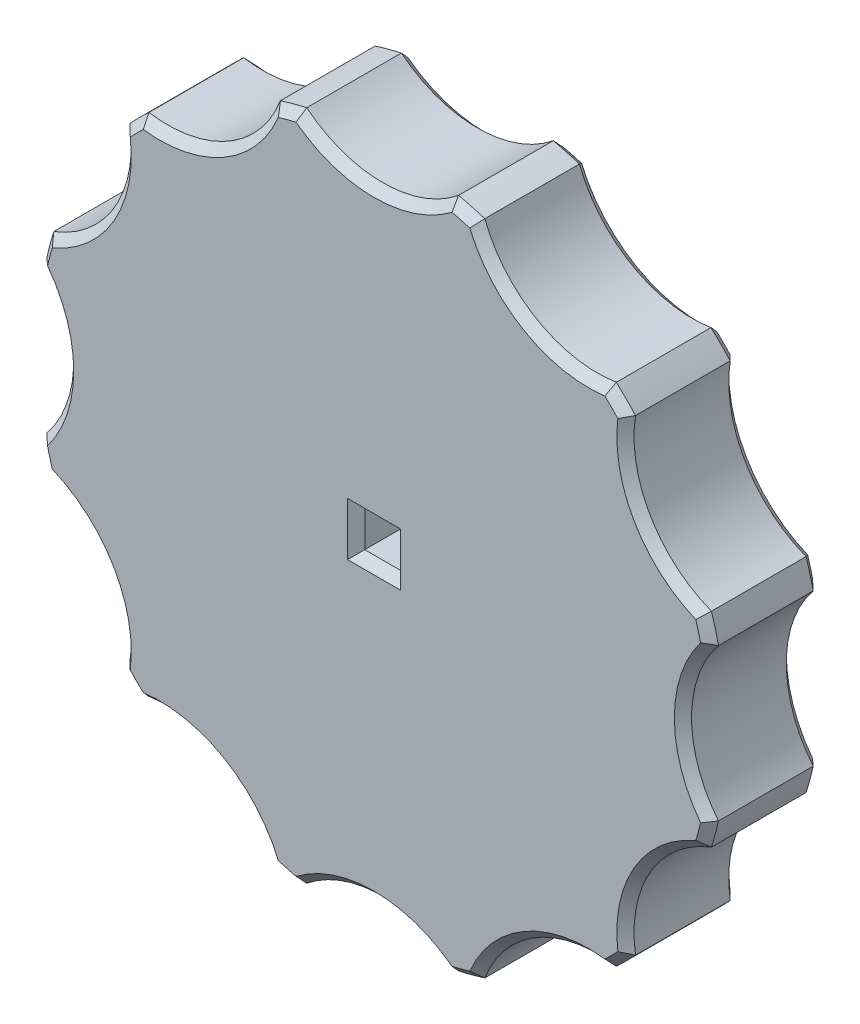
from build123d import *

# Parameters (mm, degrees)
SKIZZE1_R                       = 20
SKIZZE1_W                       = 2.08
SKIZZE1_H                       = 2.08
AUFSATZ_LINEAR_AUSTRAGEN1_DEPTH = 6.5
SCHNITT_LINEAR_AUSTRAGEN1_DEPTH = 6.5
KREISMUSTER1_COUNT              = 12
FASE1_SIZE                      = 0.5


with BuildPart() as part:
    # Skizze1 → Aufsatz-Linear austragen1 (new body)
    with BuildSketch(Plane.XY):
        with Locations(Location((0, 0, 0), (0, 0, 180))):
            Circle(SKIZZE1_R)
        Rectangle(SKIZZE1_W, SKIZZE1_H, mode=Mode.SUBTRACT)
    extrude(amount=AUFSATZ_LINEAR_AUSTRAGEN1_DEPTH)

    # Skizze2 → Schnitt-Linear austragen1 (cut)
    with BuildSketch(Plane.XY):
        with BuildLine():
            Line((-5.535516041, 20.658827109), (5.535516041, 20.658827109))
            ThreePointArc((5.535516041, 20.658827109), (0, 17.943458035), (-5.535516041, 20.658827109))
        make_face()
    schnitt_linear_austragen1 = extrude(amount=SCHNITT_LINEAR_AUSTRAGEN1_DEPTH, mode=Mode.SUBTRACT)

    # Kreismuster1: Schnitt-Linear austragen1 ×12 about axis
    kreismuster1_axis = Axis((0, 0, 0), (0, 0, 1))
    for i in range(1, KREISMUSTER1_COUNT):
        add(schnitt_linear_austragen1.rotate(kreismuster1_axis, i * 360 / KREISMUSTER1_COUNT), mode=Mode.SUBTRACT)

    # Fase1
    fase1_edges = [part.edges().sort_by_distance(p)[0] for p in [
        (1.04, 0, 6.5),
        (0, 1.04, 6.5),
        (-19.318516526, 5.176380902, 0),
        (-15.53949049, 8.971729017, 0),
        (-19.318516526, 5.176380902, 6.5),
        (-15.53949049, 8.971729017, 6.5),
        (-14.142135624, -14.142135624, 0),
        (-15.53949049, -8.971729017, 0),
        (-14.142135624, -14.142135624, 6.5),
        (-15.53949049, -8.971729017, 6.5),
        (5.176380902, -19.318516526, 0),
        (0, -17.943458035, 0),
        (5.176380902, -19.318516526, 6.5),
        (0, -17.943458035, 6.5),
        (19.318516526, -5.176380902, 0),
        (15.53949049, -8.971729017, 0),
        (19.318516526, -5.176380902, 6.5),
        (15.53949049, -8.971729017, 6.5),
        (14.142135624, 14.142135624, 0),
        (15.53949049, 8.971729017, 0),
        (14.142135624, 14.142135624, 6.5),
        (15.53949049, 8.971729017, 6.5),
        (-5.176380902, 19.318516526, 6.5),
        (-5.176380902, 19.318516526, 0),
        (0, 17.943458035, 0),
        (0, 17.943458035, 6.5),
        (-14.142135624, 14.142135624, 0),
        (-19.318516526, -5.176380902, 0),
        (-5.176380902, -19.318516526, 0),
        (14.142135624, -14.142135624, 0),
        (19.318516526, 5.176380902, 0),
        (5.176380902, 19.318516526, 0),
        (-8.971729017, 15.53949049, 0),
        (-17.943458035, 0, 0),
        (-8.971729017, -15.53949049, 0),
        (8.971729017, -15.53949049, 0),
        (17.943458035, 0, 0),
        (8.971729017, 15.53949049, 0),
        (-14.142135624, 14.142135624, 6.5),
        (-19.318516526, -5.176380902, 6.5),
        (-5.176380902, -19.318516526, 6.5),
        (14.142135624, -14.142135624, 6.5),
        (19.318516526, 5.176380902, 6.5),
        (5.176380902, 19.318516526, 6.5),
        (8.971729017, 15.53949049, 6.5),
        (17.943458035, 0, 6.5),
        (8.971729017, -15.53949049, 6.5),
        (-8.971729017, -15.53949049, 6.5),
        (-1.04, 0, 0),
        (0, -1.04, 0),
        (-17.943458035, 0, 6.5),
        (1.04, 0, 0),
        (-8.971729017, 15.53949049, 6.5),
        (0, 1.04, 0),
        (-1.04, 0, 6.5),
        (0, -1.04, 6.5),
    ]]
    chamfer(fase1_edges, length=FASE1_SIZE)


solid = part.part
